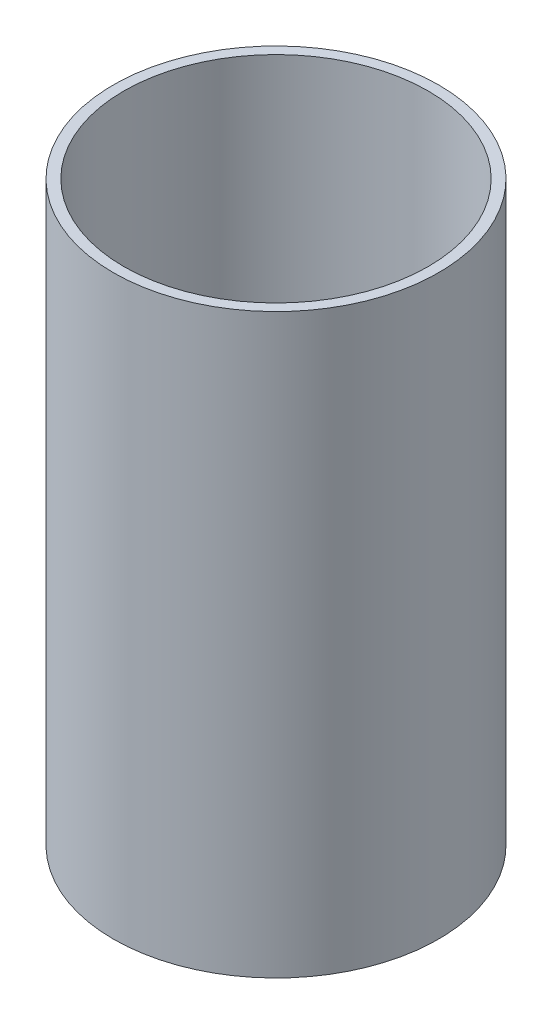
from build123d import *


with BuildPart() as part:
    # Sketch1 → Revolve1 (revolve)
    with BuildSketch(Plane(origin=(0, 0, 0), x_dir=(0, 0, -1), z_dir=(1, 0, 0)), mode=Mode.PRIVATE) as revolve1_sk:
        Polygon((0, 0), (31, 0), (31, 110), (29, 110), (29, 2), (0, 2), align=None)
    revolve(revolve1_sk.sketch.rotate(Axis((0, 2, 0), (0, -1, 0)), 180), axis=Axis((0, 2, 0), (0, -1, 0)))


solid = part.part
